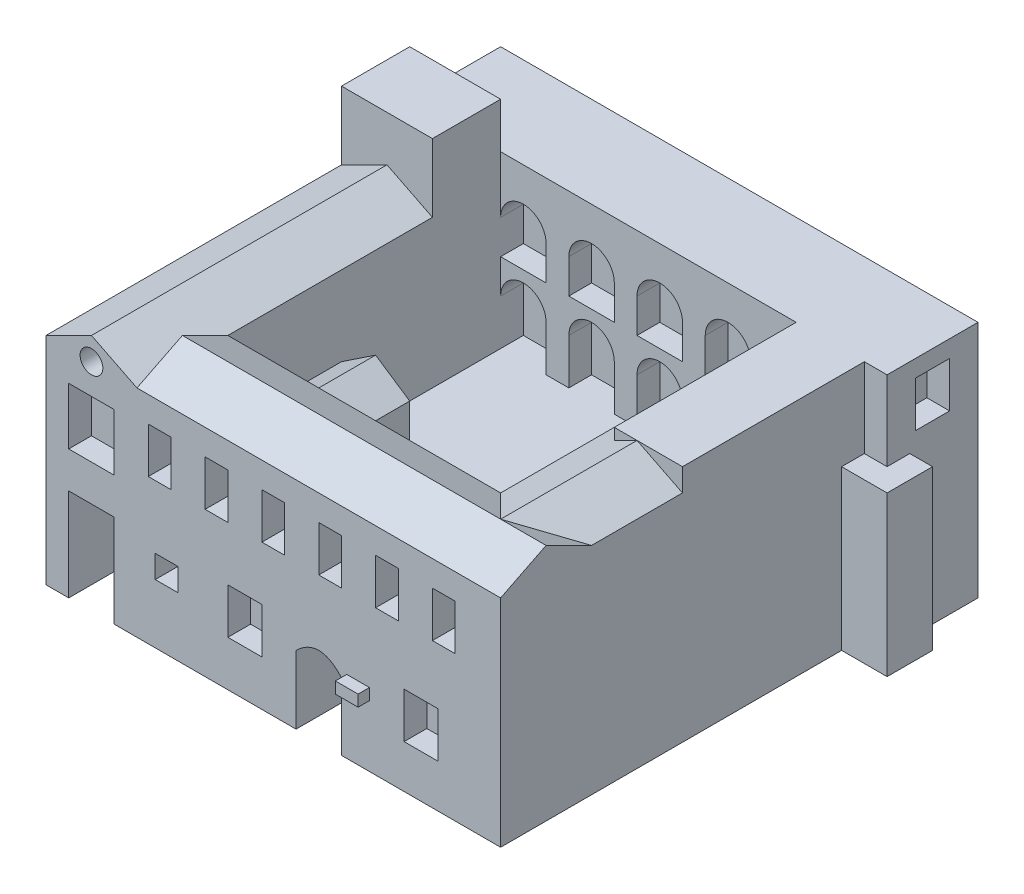
from build123d import *
from build123d.topology import SkipClean

# Parameters (mm, degrees)
CROQUIS1_W               = 20
CROQUIS1_H               = 20
SALIENTE_EXTRUIR1_DEPTH  = 2
CROQUIS2_W               = 20
CROQUIS2_H               = 20
CROQUIS2_W_2             = 12
CROQUIS2_H_2             = 12
SALIENTE_EXTRUIR2_DEPTH  = 6.5
CROQUIS3_W               = 4
CROQUIS3_H               = 3
SALIENTE_EXTRUIR3_DEPTH  = 3
SALIENTE_EXTRUIR4_REACH  = 27.145
SALIENTE_EXTRUIR5_DEPTH  = 16
SALIENTE_EXTRUIR6_REACH  = 27.145
SALIENTE_EXTRUIR7_DEPTH  = 1
CROQUIS8_W               = 1
CROQUIS8_H               = 4
SALIENTE_EXTRUIR8_DEPTH  = 9.5
CROQUIS9_W               = 2
CROQUIS9_H               = 2
SALIENTE_EXTRUIR9_DEPTH  = 6
CROQUIS10_W              = 12
CROQUIS10_H              = 1
SALIENTE_EXTRUIR10_DEPTH = 4
SALIENTE_EXTRUIR11_DEPTH = 4
CROQUIS13_R              = 0.5
CROQUIS13_W              = 2
CROQUIS13_H              = 3.077838793
CROQUIS13_H_2            = 2.5
CROQUIS13_W_2            = 1
CROQUIS13_H_3            = 2
CROQUIS13_H_4            = 1
CROQUIS13_W_3            = 1.5
CROQUIS13_H_5            = 0.5
CORTAR_EXTRUIR1_DEPTH    = 1
CROQUIS14_W              = 2
CROQUIS14_H              = 3.077838793
CORTAR_EXTRUIR2_DEPTH    = 1
CORTAR_EXTRUIR3_DEPTH    = 1
CROQUIS17_W              = 1
CROQUIS17_H              = 0.5
SALIENTE_EXTRUIR13_DEPTH = 1.5
CROQUIS18_W              = 1.5
CROQUIS18_H              = 2
CORTAR_EXTRUIR4_DEPTH    = 1
CORTAR_EXTRUIR5_DEPTH    = 1
CORTAR_EXTRUIR6_DEPTH    = 1
CORTAR_EXTRUIR7_DEPTH    = 1
CORTAR_EXTRUIR8_DEPTH    = 2
SALIENTE_EXTRUIR14_DEPTH = 1
CROQUIS28_R              = 1.575
CORTAR_EXTRUIR11_DEPTH   = 4.25
CORTAR_EXTRUIR12_START   = -1.5
CROQUIS30_R              = 1.575
CORTAR_EXTRUIR12_DEPTH   = 1.5


with BuildPart() as part:
    # Croquis1 → Saliente-Extruir1 (new body)
    with BuildSketch(Plane(origin=(0, 0, 0), x_dir=(1, 0, 0), z_dir=(0, 1, 0))):
        Rectangle(CROQUIS1_W, CROQUIS1_H)
    extrude(amount=SALIENTE_EXTRUIR1_DEPTH)

    # Croquis2 → Saliente-Extruir2 (add)
    with BuildSketch(Plane(origin=(0, 2, 0), x_dir=(1, 0, 0), z_dir=(0, 1, 0))):
        Rectangle(CROQUIS2_W, CROQUIS2_H)
        Rectangle(CROQUIS2_W_2, CROQUIS2_H_2, mode=Mode.SUBTRACT)
    extrude(amount=SALIENTE_EXTRUIR2_DEPTH)

    # Croquis3 → Saliente-Extruir3 (add)
    with BuildSketch(Plane(origin=(0, 8.5, 0), x_dir=(1, 0, 0), z_dir=(0, 1, 0))):
        with Locations((-8, 4.5)):
            Rectangle(CROQUIS3_W, CROQUIS3_H)
    extrude(amount=SALIENTE_EXTRUIR3_DEPTH)

    # Saliente-Extruir4: up to this face of the body (flat: up to its plane)
    saliente_extruir4_end = Plane(part.part.faces().sort_by_distance((-8, 10, -3))[0])
    # Croquis4 → Saliente-Extruir4 (add, up to the picked face)
    with BuildSketch(Plane.XY.offset(10), mode=Mode.PRIVATE) as saliente_extruir4_sk1:
        Polygon((-10, 8.5), (-8, 9.5), (-6, 8.5), align=None)
    saliente_extruir4_tool1 = split(extrude(saliente_extruir4_sk1.sketch, amount=-SALIENTE_EXTRUIR4_REACH, mode=Mode.PRIVATE), bisect_by=saliente_extruir4_end, keep=Keep.BOTH, mode=Mode.PRIVATE)
    add(saliente_extruir4_tool1.solids().sort_by(Axis((-8, 8.833333, 10), (0, 0, -1)))[0])

    # Croquis5 → Saliente-Extruir5 (add)
    with BuildSketch(Plane(origin=(10, 0, 0), x_dir=(0, 0, -1), z_dir=(1, 0, 0))):
        Polygon((-10, 8.5), (-8, 9.5), (-6, 8.5), align=None)
    extrude(amount=-SALIENTE_EXTRUIR5_DEPTH)

    # Saliente-Extruir6: up to this plane
    saliente_extruir6_end = Plane(origin=(-6, 9.5, 8), z_dir=(0, 0.894427190999916, -0.447213595499958))
    # Croquis6 → Saliente-Extruir6 (add, up to the surface)
    with BuildSketch(Plane(origin=(0, 0, -10), x_dir=(-1, 0, 0), z_dir=(0, 0, -1)), mode=Mode.PRIVATE) as saliente_extruir6_sk1:
        Polygon((-10, 8.5), (-6, 8.5), (-8, 9.5), align=None)
    saliente_extruir6_tool1 = split(extrude(saliente_extruir6_sk1.sketch, amount=-SALIENTE_EXTRUIR6_REACH, mode=Mode.PRIVATE), bisect_by=saliente_extruir6_end, keep=Keep.BOTH, mode=Mode.PRIVATE)
    add(saliente_extruir6_tool1.solids().sort_by_distance((8, 8.833333, -10))[0])

    # Croquis7 → Saliente-Extruir7 (add)
    with BuildSketch(Plane(origin=(0, 8.5, 0), x_dir=(1, 0, 0), z_dir=(0, 1, 0))):
        Polygon((6, 10), (10, 10), (10, -2), (7, -2), (7, 6), (6, 6), (-6, 6), (-10, 6), (-10, 10), align=None)
    extrude(amount=SALIENTE_EXTRUIR7_DEPTH)

    # Croquis8 → Saliente-Extruir8 (add)
    with BuildSketch(Plane(origin=(0, 0, 0), x_dir=(1, 0, 0), z_dir=(0, 1, 0))):
        with Locations((10.5, 8)):
            Rectangle(CROQUIS8_W, CROQUIS8_H)
    extrude(amount=SALIENTE_EXTRUIR8_DEPTH)

    # Croquis9 → Saliente-Extruir9 (add)
    with BuildSketch(Plane(origin=(0, 0, 0), x_dir=(1, 0, 0), z_dir=(0, 1, 0))):
        with Locations((11, 6)):
            Rectangle(CROQUIS9_W, CROQUIS9_H)
    extrude(amount=SALIENTE_EXTRUIR9_DEPTH)

    # Croquis10 → Saliente-Extruir10 (add)
    with BuildSketch(Plane(origin=(0, 2, 0), x_dir=(1, 0, 0), z_dir=(0, 1, 0))):
        with Locations((0, -5.5)):
            Rectangle(CROQUIS10_W, CROQUIS10_H)
    extrude(amount=SALIENTE_EXTRUIR10_DEPTH)

    # Croquis12 → Saliente-Extruir11 (add)
    with BuildSketch(Plane(origin=(0, 0, 5), x_dir=(-1, 0, 0), z_dir=(0, 0, -1))):
        Polygon((3, 5), (3, 2), (6, 2), (6, 5), (4.5, 6), align=None)
    extrude(amount=SALIENTE_EXTRUIR11_DEPTH)

    # Croquis13 → Cortar-Extruir1 (cut)
    with BuildSketch(Plane.XY.offset(10)):
        with Locations((-8, 8.5)):
            Circle(CROQUIS13_R)
        with Locations((-8, 1.538919397)):
            Rectangle(CROQUIS13_W, CROQUIS13_H)
        with Locations((-8, 5.926287157)):
            Rectangle(CROQUIS13_W, CROQUIS13_H_2)
        with BuildLine():
            Line((1, 0), (1, 2))
            add(Edge.make_bspline(
                [(1, 2), (1.676528532, 2.664790301), (2.342911723, 2.68037442), (3, 1.964285714)],
                knots=[0, 0, 0, 0, 1, 1, 1, 1], degree=3))
            Line((3, 1.964285714), (3, 0))
            Line((3, 0), (1, 0))
        make_face()
        with Locations((-5, 6.375)):
            Rectangle(CROQUIS13_W_2, CROQUIS13_H_3)
        with Locations((-2.5, 6.375)):
            Rectangle(CROQUIS13_W_2, CROQUIS13_H_3)
        with Locations((0, 6.375)):
            Rectangle(CROQUIS13_W_2, CROQUIS13_H_3)
        with Locations((2.5, 6.375)):
            Rectangle(CROQUIS13_W_2, CROQUIS13_H_3)
        with Locations((5, 6.375)):
            Rectangle(CROQUIS13_W_2, CROQUIS13_H_3)
        with Locations((7.5, 6.375)):
            Rectangle(CROQUIS13_W_2, CROQUIS13_H_3)
        with Locations((-4.695516199, 2.101705646)):
            Rectangle(CROQUIS13_W_2, CROQUIS13_H_4)
        with Locations((-1.25, 2)):
            Rectangle(CROQUIS13_W_3, CROQUIS13_H_3)
        with Locations((3.729414838, 1.951260449)):
            Rectangle(CROQUIS13_W_2, CROQUIS13_H_5)
        with Locations((6.50188823, 1.901751996)):
            Rectangle(CROQUIS13_W_3, CROQUIS13_H_3)
    extrude(amount=-CORTAR_EXTRUIR1_DEPTH, mode=Mode.SUBTRACT)

    # Croquis14 → Cortar-Extruir2 (cut)
    with BuildSketch(Plane.XY.offset(9)):
        with Locations((-8, 1.538919397)):
            Rectangle(CROQUIS14_W, CROQUIS14_H)
    extrude(amount=-CORTAR_EXTRUIR2_DEPTH, mode=Mode.SUBTRACT)

    # Croquis16 → Cortar-Extruir3 (cut)
    with BuildSketch(Plane.XY.offset(9)):
        with BuildLine():
            Line((1, 0), (3, 0))
            Line((3, 0), (3, 1.964285714))
            add(Edge.make_bspline(
                [(3, 1.964285714), (2.342911723, 2.68037442), (1.676528532, 2.664790301), (1.000000001, 2.000000001)],
                knots=[0, 0, 0, 0, 1, 1, 1, 1], degree=3))
            Line((1.000000001, 2.000000001), (1, 0))
        make_face()
    extrude(amount=-CORTAR_EXTRUIR3_DEPTH, mode=Mode.SUBTRACT)

    # Croquis17 → Saliente-Extruir13 (add)
    with BuildSketch(Plane.XY.offset(9)):
        with Locations((3.729414838, 1.951260449)):
            Rectangle(CROQUIS17_W, CROQUIS17_H)
    extrude(amount=SALIENTE_EXTRUIR13_DEPTH)

    # Croquis18 → Cortar-Extruir4 (cut)
    with BuildSketch(Plane(origin=(11, 0, 0), x_dir=(0, 0, -1), z_dir=(1, 0, 0))):
        with Locations((8, 7.75)):
            Rectangle(CROQUIS18_W, CROQUIS18_H)
    extrude(amount=-CORTAR_EXTRUIR4_DEPTH, mode=Mode.SUBTRACT)

    # Croquis20 → Cortar-Extruir5 (cut)
    with BuildSketch(Plane.XY.offset(-6)):
        with BuildLine():
            Line((-6, 2), (-4, 2))
            Line((-4, 2), (-4, 4))
            ThreePointArc((-4, 4), (-5, 5), (-6, 4))
            Line((-6, 4), (-6, 2))
        make_face()
        with BuildLine():
            Line((-3, 4), (-3, 2))
            Line((-3, 2), (-1, 2))
            Line((-1, 2), (-1, 4))
            ThreePointArc((-1, 4), (-2, 5), (-3, 4))
        make_face()
        with BuildLine():
            Line((0, 4), (0, 2))
            Line((0, 2), (2, 2))
            Line((2, 2), (2, 4))
            ThreePointArc((2, 4), (1, 5), (0, 4))
        make_face()
        with BuildLine():
            Line((3, 4), (3, 2))
            Line((3, 2), (5, 2))
            Line((5, 2), (5, 4))
            ThreePointArc((5, 4), (4, 5), (3, 4))
        make_face()
        with BuildLine():
            Line((5, 7), (5, 5.5))
            Line((5, 5.5), (3, 5.5))
            Line((3, 5.5), (3, 7))
            ThreePointArc((3, 7), (4, 8), (5, 7))
        make_face()
        with BuildLine():
            Line((2, 7), (2, 5.5))
            Line((2, 5.5), (0, 5.5))
            Line((0, 5.5), (0, 7))
            ThreePointArc((0, 7), (1, 8), (2, 7))
        make_face()
        with BuildLine():
            Line((-1, 7), (-1, 5.5))
            Line((-1, 5.5), (-3, 5.5))
            Line((-3, 5.5), (-3, 7))
            ThreePointArc((-3, 7), (-2, 8), (-1, 7))
        make_face()
        with BuildLine():
            Line((-4, 7), (-4, 5.5))
            Line((-4, 5.5), (-6, 5.5))
            Line((-6, 5.5), (-6, 7))
            ThreePointArc((-6, 7), (-5, 8), (-4, 7))
        make_face()
    extrude(amount=-CORTAR_EXTRUIR5_DEPTH, mode=Mode.SUBTRACT)

    # Croquis22 → Cortar-Extruir6 (cut)
    with BuildSketch(Plane.ZY.offset(-6)):
        with BuildLine():
            Line((-6, 2), (-4, 2))
            Line((-4, 2), (-4, 4.054815519))
            ThreePointArc((-4, 4.054815519), (-5, 5.054815519), (-6, 4.054815519))
            Line((-6, 4.054815519), (-6, 2))
        make_face()
        with BuildLine():
            Line((-3, 4.054815519), (-3, 2))
            Line((-3, 2), (-1, 2))
            Line((-1, 2), (-1, 4.054815519))
            ThreePointArc((-1, 4.054815519), (-2, 5.054815519), (-3, 4.054815519))
        make_face()
        with BuildLine():
            Line((0, 4.054815519), (0, 2))
            Line((0, 2), (2, 2))
            Line((2, 2), (2, 4.054815519))
            ThreePointArc((2, 4.054815519), (1, 5.054815519), (0, 4.054815519))
        make_face()
        with BuildLine():
            Line((2.998498756, 4.054815519), (3, 2))
            Line((3, 2), (5, 2))
            Line((5, 2), (5, 4.109631038))
            ThreePointArc((5, 4.109631038), (3.972581964, 5.055941381), (2.998498756, 4.054815519))
        make_face()
        with BuildLine():
            Line((5, 7.109631038), (5, 5.609631038))
            Line((5, 5.609631038), (3, 5.609631038))
            Line((3, 5.609631038), (3, 7.109631038))
            ThreePointArc((3, 7.109631038), (4, 8.109631038), (5, 7.109631038))
        make_face()
        with BuildLine():
            Line((2, 7.109631038), (2, 5.609631038))
            Line((2, 5.609631038), (0, 5.609631038))
            Line((0, 5.609631038), (0, 7.109631038))
            ThreePointArc((0, 7.109631038), (1, 8.109631038), (2, 7.109631038))
        make_face()
        with BuildLine():
            Line((-0.939273689, 7.109631038), (-0.939273689, 5.609631038))
            Line((-0.939273689, 5.609631038), (-3.060726311, 5.609631038))
            Line((-3.060726311, 5.609631038), (-3.060726311, 7.109631038))
            ThreePointArc((-3.060726311, 7.109631038), (-2, 8.170357348), (-0.939273689, 7.109631038))
        make_face()
        with BuildLine():
            Line((-4, 7.109631038), (-4, 5.609631038))
            Line((-4, 5.609631038), (-6, 5.609631038))
            Line((-6, 5.609631038), (-6, 7.109631038))
            ThreePointArc((-6, 7.109631038), (-5, 8.109631038), (-4, 7.109631038))
        make_face()
    extrude(amount=-CORTAR_EXTRUIR6_DEPTH, mode=Mode.SUBTRACT)

    # Croquis26 → Cortar-Extruir7 (cut)
    with SkipClean():  # the faces are left unmerged after this step: merging them gives an invalid solid
        with BuildSketch(Plane(origin=(0, 0, 5), x_dir=(-1, 0, 0), z_dir=(0, 0, -1))):
            with BuildLine():
                Line((-5, 2), (-3, 2))
                Line((-3, 2), (-3, 4.17217407))
                ThreePointArc((-3, 4.17217407), (-4, 5.17217407), (-5, 4.17217407))
                Line((-5, 4.17217407), (-5, 2))
            make_face()
            with BuildLine():
                Line((-2.000000267, 4.17217407), (-2.000000267, 2.000730598))
                Line((-2.000000267, 2.000730598), (-2.67e-07, 2.000730598))
                Line((-2.67e-07, 2.000730598), (-2.67e-07, 4.17217407))
                ThreePointArc((-2.67e-07, 4.17217407), (-1.000000267, 5.17217407), (-2.000000267, 4.17217407))
            make_face()
            with BuildLine():
                Line((0.999999733, 4.17217407), (0.999999733, 2.000730598))
                Line((0.999999733, 2.000730598), (2.999999733, 2.000730598))
                Line((2.999999733, 2.000730598), (2.999999733, 4.17217407))
                ThreePointArc((2.999999733, 4.17217407), (1.999999733, 5.17217407), (0.999999733, 4.17217407))
            make_face()
        extrude(amount=-CORTAR_EXTRUIR7_DEPTH, mode=Mode.SUBTRACT)

    # Croquis27 → Cortar-Extruir8 (cut)
    with SkipClean():  # the faces are left unmerged after this step: merging them gives an invalid solid
        with BuildSketch(Plane(origin=(0, 0, 1), x_dir=(-1, 0, 0), z_dir=(0, 0, -1))):
            with BuildLine():
                Line((3.5, 2), (5.5, 2))
                Line((5.5, 2), (5.5, 4.17217407))
                ThreePointArc((5.5, 4.17217407), (4.5, 5.17217407), (3.5, 4.17217407))
                Line((3.5, 4.17217407), (3.5, 2))
            make_face()
        extrude(amount=-CORTAR_EXTRUIR8_DEPTH, mode=Mode.SUBTRACT)

    # Croquis29 → Saliente-Extruir14 (add)
    with SkipClean():  # the faces are left unmerged after this step: merging them gives an invalid solid
        with BuildSketch(Plane.XZ):
            Polygon((3, 8), (1, 8), (1, 10), (-7, 10), (-7, 8), (-9, 8), (-9, 10), (-10, 10), (-10, -10), (11, -10), (11, -7), (12, -7), (12, -5), (10, -5), (10, 10), (3, 10), align=None)
        extrude(amount=SALIENTE_EXTRUIR14_DEPTH)

    # Croquis28 → Cortar-Extruir11 (cut)
    with SkipClean():  # the faces are left unmerged after this step: merging them gives an invalid solid
        with BuildSketch(Plane.XZ):
            with Locations(Location((0, 0, 0), (0, 0, 90))):
                Circle(CROQUIS28_R)
        extrude(amount=CORTAR_EXTRUIR11_DEPTH, mode=Mode.SUBTRACT)

    # Croquis30 → Cortar-Extruir12 (cut)
    with SkipClean():  # the faces are left unmerged after this step: merging them gives an invalid solid
        with BuildSketch(Plane.XZ.offset(CORTAR_EXTRUIR12_START)):
            with Locations(Location((0, 0, 0), (0, 0, 90))):
                Circle(CROQUIS30_R)
        extrude(amount=CORTAR_EXTRUIR12_DEPTH, mode=Mode.SUBTRACT)


solid = part.part
